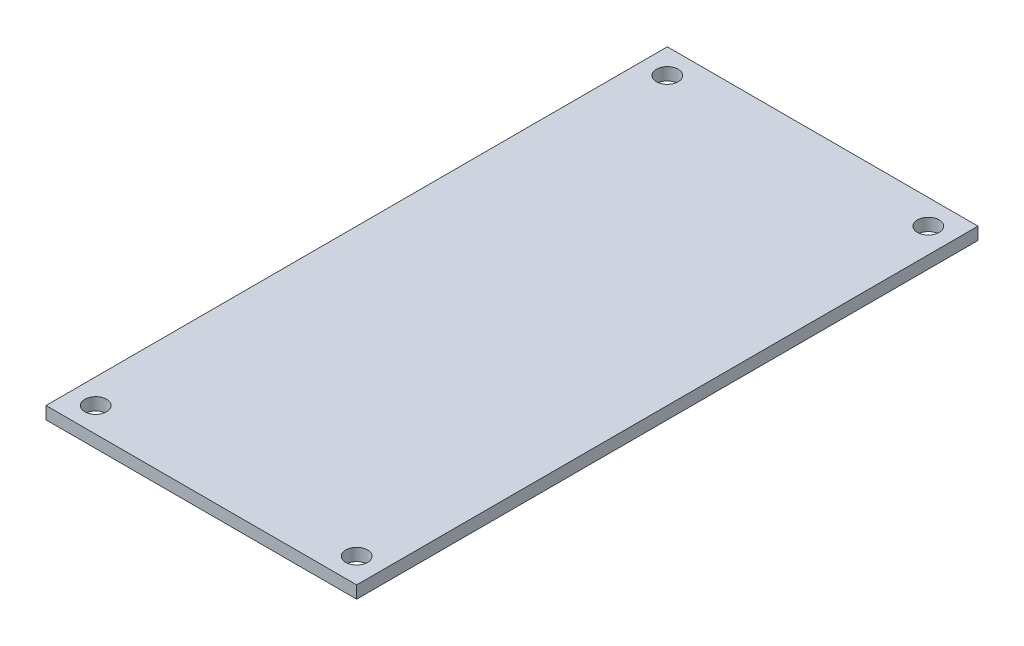
from build123d import *

# Parameters (mm, degrees)
SKETCH_1_W      = 50
SKETCH_1_H      = 100
SKETCH_1_R      = 1.75
EXTRUDE_1_DEPTH = 2


with BuildPart() as part:
    # 스케치1 → 보스-돌출1 (new body)
    with BuildSketch(Plane(origin=(0, 0, 0), x_dir=(1, 0, 0), z_dir=(0, 1, 0))):
        Rectangle(SKETCH_1_W, SKETCH_1_H)
        with Locations(Location((-21, 46, 0), (0, 0, 270))):
            Circle(SKETCH_1_R, mode=Mode.SUBTRACT)
        with Locations(Location((21, 46, 0), (0, 0, 90))):
            Circle(SKETCH_1_R, mode=Mode.SUBTRACT)
        with Locations(Location((21, -46, 0), (0, 0, 270))):
            Circle(SKETCH_1_R, mode=Mode.SUBTRACT)
        with Locations(Location((-21, -46, 0), (0, 0, 90))):
            Circle(SKETCH_1_R, mode=Mode.SUBTRACT)
    extrude(amount=EXTRUDE_1_DEPTH)


solid = part.part
